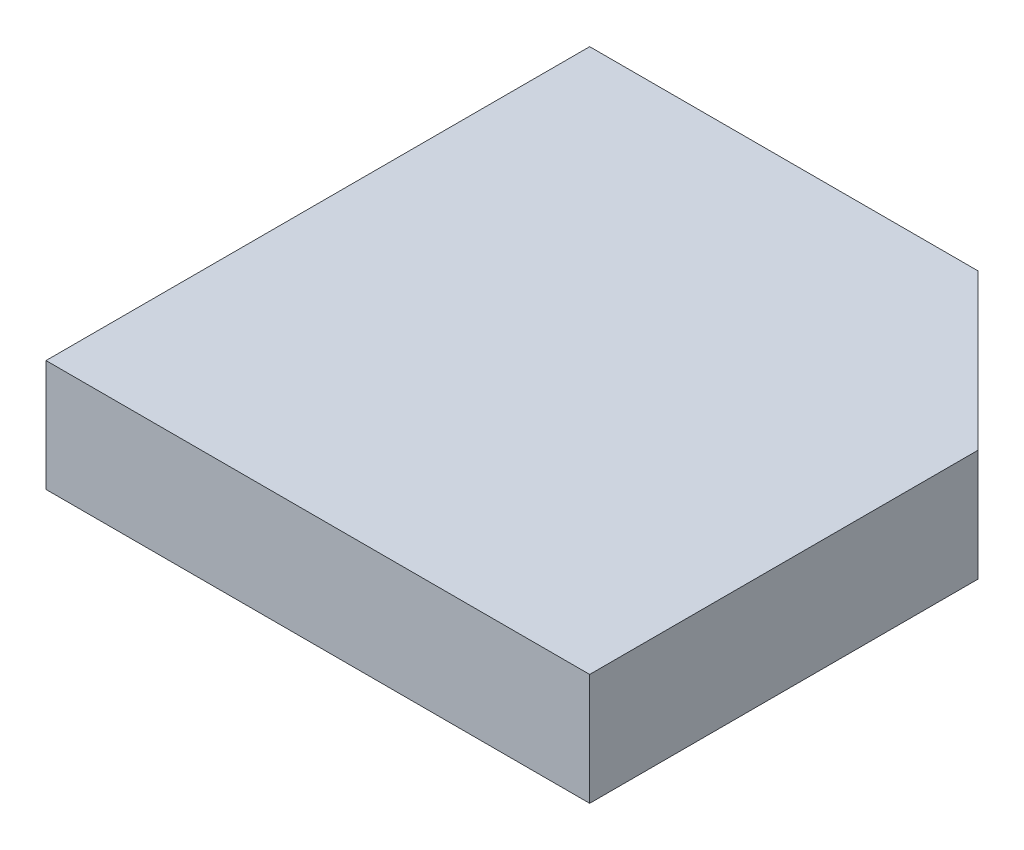
from build123d import *

# Parameters (mm, degrees)
SKETCH1_W           = 88.9
SKETCH1_H           = 88.9
BOSS_EXTRUDE1_DEPTH = 18.25625
CUT_EXTRUDE1_DEPTH  = 66.459114446


with BuildPart() as part:
    # Sketch1 → Boss-Extrude1 (new body)
    with BuildSketch(Plane(origin=(0, 0, 0), x_dir=(1, 0, 0), z_dir=(0, 1, 0))):
        Rectangle(SKETCH1_W, SKETCH1_H)
    extrude(amount=BOSS_EXTRUDE1_DEPTH)

    # Sketch2 → Cut-Extrude1 (cut, through all)
    with BuildSketch(Plane(origin=(0, 18.25625, 0), x_dir=(1, 0, 0), z_dir=(0, 1, 0))):
        Polygon((44.45, 44.45), (44.45, 19.05), (19.05, 44.45), align=None)
    extrude(amount=-CUT_EXTRUDE1_DEPTH, mode=Mode.SUBTRACT)


solid = part.part
